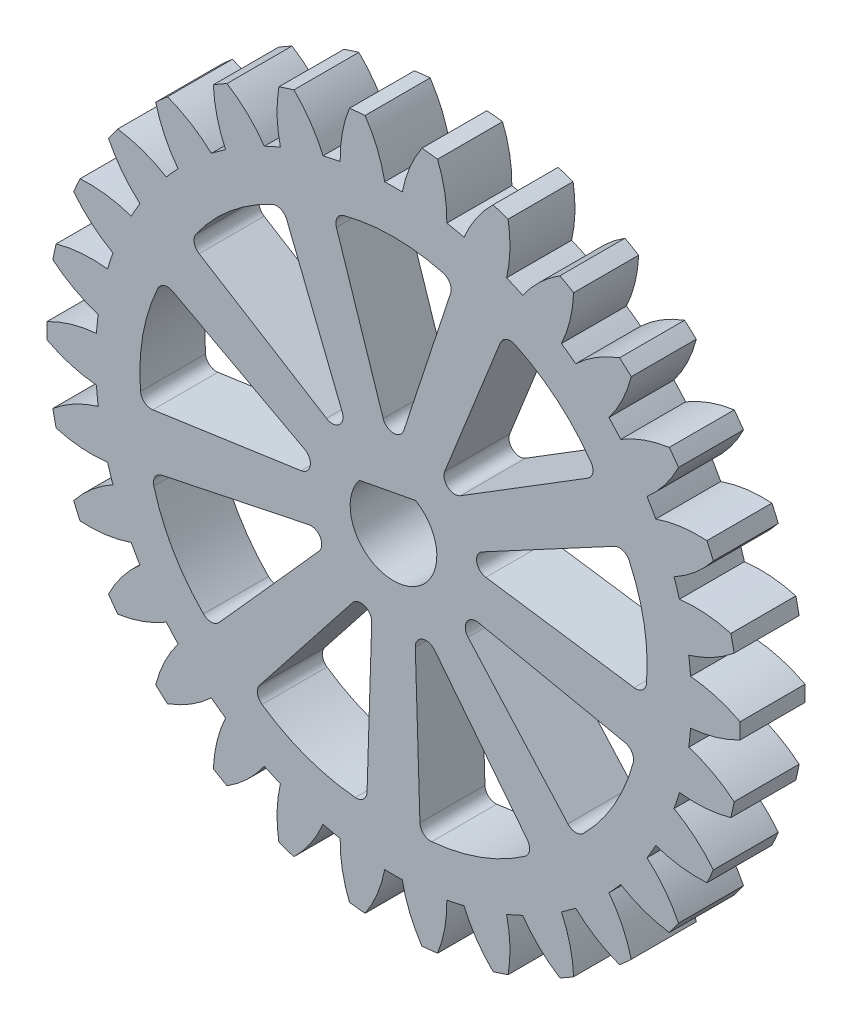
from build123d import *

# Parameters (mm, degrees)
SKETCH1_R                = 16
BOSS_EXTRUDE2_DEPTH      = 3
CUT_EXTRUDE4_DEPTH       = 23.825424421
CIRPATTERN3_COUNT        = 30
CUT_EXTRUDE6_DEPTH       = 23.787803159
FILLET6_R                = 0.5
CIRPATTERN6_COUNT        = 9
FILLET6_OF_CIRPATTERN6_R = 0.5
CUT_EXTRUDE7_DEPTH       = 23.787803159


with BuildPart() as part:
    # Sketch1 → Boss-Extrude2 (new body)
    with BuildSketch(Plane.XY):
        Circle(SKETCH1_R)
    extrude(amount=BOSS_EXTRUDE2_DEPTH)

    # Sketch7 → Cut-Extrude4 (cut, through all)
    with BuildSketch(Plane.XY.offset(3)):
        with BuildLine():
            ThreePointArc((-1.309972212, 15.946283981), (-0.747286699, 14.890480207), (-0.405262886, 13.744026411))
            ThreePointArc((-0.405262886, 13.744026411), (0, 13.75), (0.405262886, 13.744026411))
            ThreePointArc((0.405262886, 13.744026411), (0.747286699, 14.890480207), (1.309972212, 15.946283981))
            ThreePointArc((1.309972212, 15.946283981), (0, 16), (-1.309972212, 15.946283981))
        make_face()
    cut_extrude4 = extrude(amount=-CUT_EXTRUDE4_DEPTH, mode=Mode.SUBTRACT)

    # CirPattern3: Cut-Extrude4 ×30 about axis
    cirpattern3_axis = Axis((0, 0, 0), (0, 0, 1))
    for i in range(1, CIRPATTERN3_COUNT):
        add(cut_extrude4.rotate(cirpattern3_axis, i * 360 / CIRPATTERN3_COUNT), mode=Mode.SUBTRACT)

    # Sketch9 → Cut-Extrude6 (cut, through all)
    with BuildSketch(Plane(origin=(0, 0, 0), x_dir=(-1, 0, 0), z_dir=(0, 0, -1))):
        with BuildLine():
            Line((-2.797552607, 11.301828716), (0, 2.801828716))
            Line((0, 2.801828716), (2.797552607, 11.301828716))
            ThreePointArc((2.797552607, 11.301828716), (0, 11.750364942), (-2.797552607, 11.301828716))
        make_face()
    cut_extrude6 = extrude(amount=-CUT_EXTRUDE6_DEPTH, mode=Mode.SUBTRACT)

    # Fillet6
    fillet6_edges = [part.edges().sort_by_distance(p)[0] for p in [
        (2.797552607, 11.301828716, 1.5),
        (-2.797552607, 11.301828716, 1.5),
        (0, 2.801828716, 1.5),
    ]]
    fillet(fillet6_edges, radius=FILLET6_R)

    # CirPattern6: Cut-Extrude6 ×9 about axis
    cirpattern6_axis = Axis((0, 0, 0), (0, 0, 1))
    for i in range(1, CIRPATTERN6_COUNT):
        add(cut_extrude6.rotate(cirpattern6_axis, i * 360 / CIRPATTERN6_COUNT), mode=Mode.SUBTRACT)

    # Fillet6 of CirPattern6
    fillet6_of_cirpattern6_edges = [part.edges().sort_by_distance(p)[0] for p in [
        (-5.121625837, 10.455935238, 1.5),
        (-9.407725094, 6.859470932, 1.5),
        (-1.800980783, 2.146325318, 1.5),
        (-10.644338631, 4.717593457, 1.5),
        (-11.615918455, -0.792509536, 1.5),
        (-2.759262642, 0.486532451, 1.5),
        (-11.18644708, -3.228162732, 1.5),
        (-8.388894474, -8.073665984, 1.5),
        (-2.426454845, -1.400914358, 1.5),
        (-6.494292618, -9.663425702, 1.5),
        (-1.236613536, -11.577064389, 1.5),
        (-0.958281859, -2.632857769, 1.5),
        (1.236613536, -11.577064389, 1.5),
        (6.494292618, -9.663425702, 1.5),
        (0.958281859, -2.632857769, 1.5),
        (8.388894474, -8.073665984, 1.5),
        (11.18644708, -3.228162732, 1.5),
        (2.426454845, -1.400914358, 1.5),
        (11.615918455, -0.792509536, 1.5),
        (10.644338631, 4.717593457, 1.5),
        (2.759262642, 0.486532451, 1.5),
        (9.407725094, 6.859470932, 1.5),
        (5.121625837, 10.455935238, 1.5),
        (1.800980783, 2.146325318, 1.5),
    ]]
    fillet(fillet6_of_cirpattern6_edges, radius=FILLET6_OF_CIRPATTERN6_R)

    # Sketch10 → Cut-Extrude7 (cut, through all)
    with BuildSketch(Plane(origin=(0, 0, 0), x_dir=(-1, 0, 0), z_dir=(0, 0, -1))):
        with BuildLine():
            Line((-1.019702113, 1.720525385), (1.579568096, 1.226769999))
            ThreePointArc((1.579568096, 1.226769999), (-0.373243989, -1.964863589), (-1.019702113, 1.720525385))
        make_face()
    extrude(amount=-CUT_EXTRUDE7_DEPTH, mode=Mode.SUBTRACT)


solid = part.part
